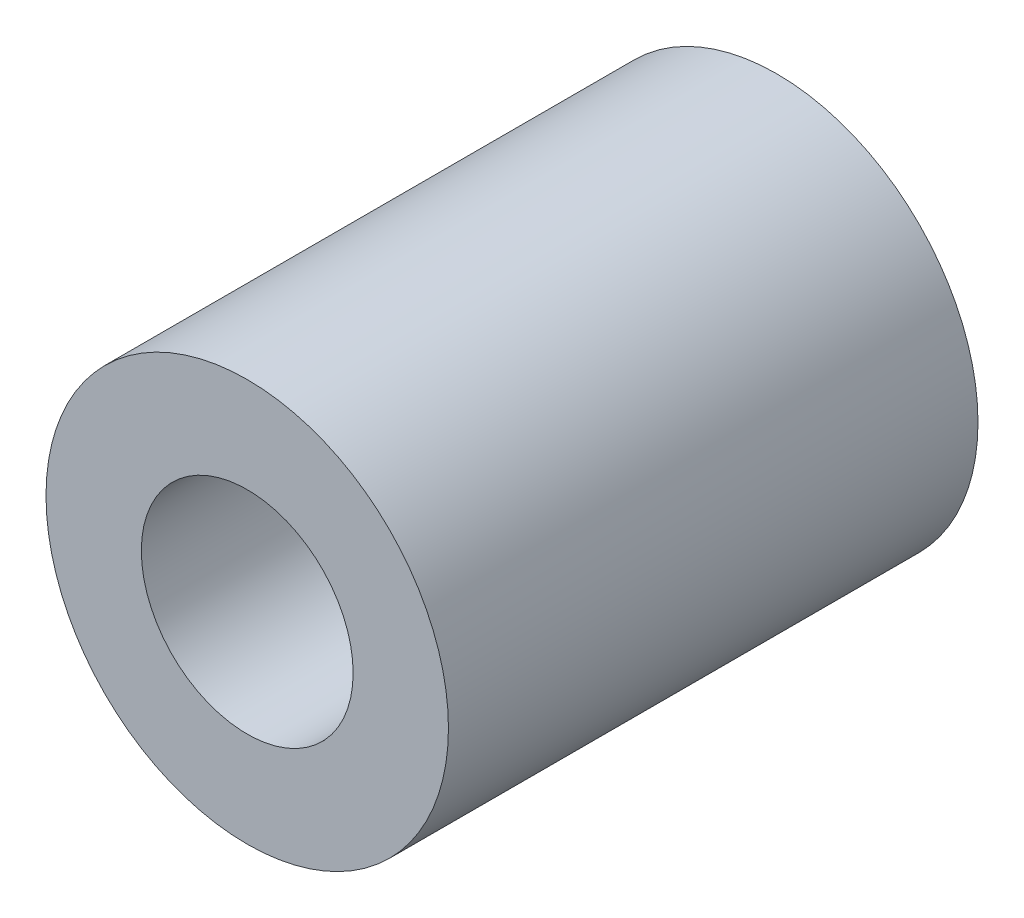
from build123d import *

# Parameters (mm, degrees)
ESQUISSE1_R        = 9.5
ESQUISSE1_R_2      = 5
BOSS_EXTRU_1_DEPTH = 25


with BuildPart() as part:
    # Esquisse1 → Boss.-Extru.1 (new body)
    with BuildSketch(Plane.XY):
        Circle(ESQUISSE1_R)
        Circle(ESQUISSE1_R_2, mode=Mode.SUBTRACT)
    extrude(amount=BOSS_EXTRU_1_DEPTH)


solid = part.part
